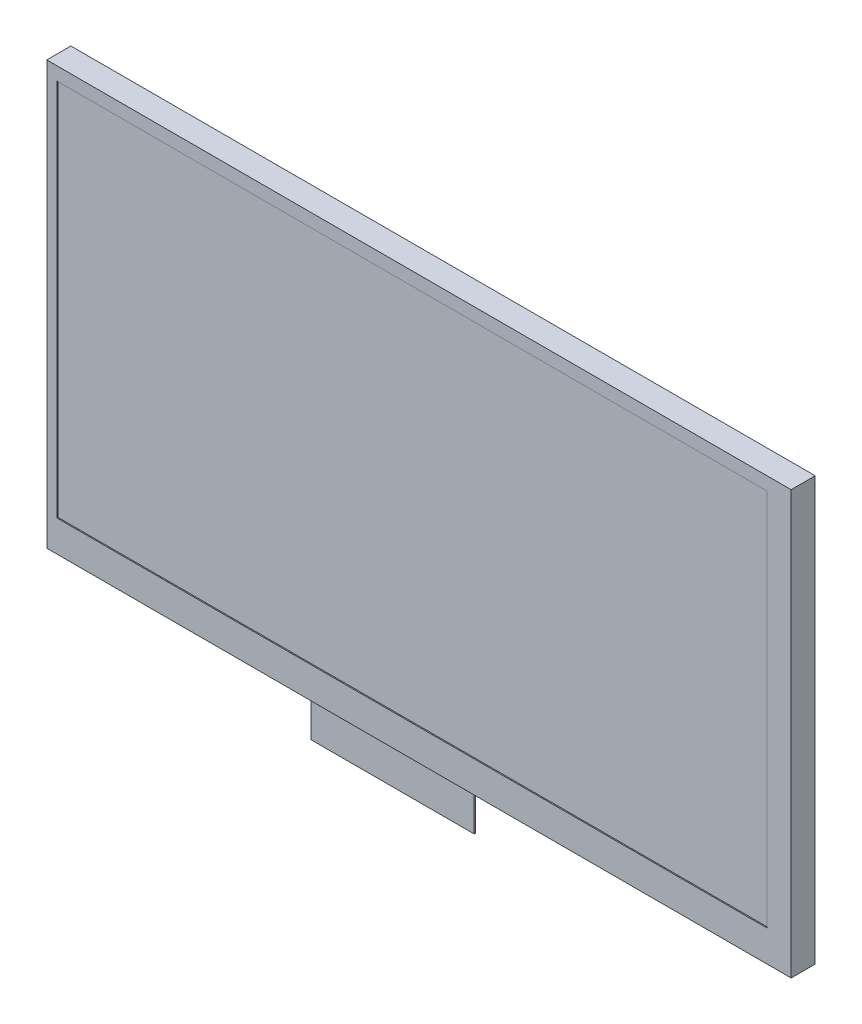
from build123d import *

# Parameters (mm, degrees)
SKETCH1_W           = 176.022
SKETCH1_H           = 100
BOSS_EXTRUDE1_DEPTH = 5.7
SKETCH1_3_W         = 167.9702
SKETCH1_3_H         = 89.4844
CUT_EXTRUDE1_DEPTH  = 0.254
BOSS_EXTRUDE2_START = -1.1684
SKETCH2_W           = 38.53942
SKETCH2_H           = 9.144
BOSS_EXTRUDE2_DEPTH = 0.3048


with BuildPart() as part:
    # Sketch1 → Boss-Extrude1 (new body)
    with BuildSketch(Plane.XY):
        Rectangle(SKETCH1_W, SKETCH1_H)
    extrude(amount=-BOSS_EXTRUDE1_DEPTH)

    # Sketch1<3> → Cut-Extrude1 (cut)
    with BuildSketch(Plane.XY):
        with Locations((-1.6383, 2.1336)):
            Rectangle(SKETCH1_3_W, SKETCH1_3_H)
    extrude(amount=-CUT_EXTRUDE1_DEPTH, mode=Mode.SUBTRACT)

    # Sketch2 → Boss-Extrude2 (add)
    with BuildSketch(Plane.XY.offset(BOSS_EXTRUDE2_START)):
        with Locations((-7.37489, -54.572)):
            Rectangle(SKETCH2_W, SKETCH2_H)
    extrude(amount=-BOSS_EXTRUDE2_DEPTH)


solid = part.part
